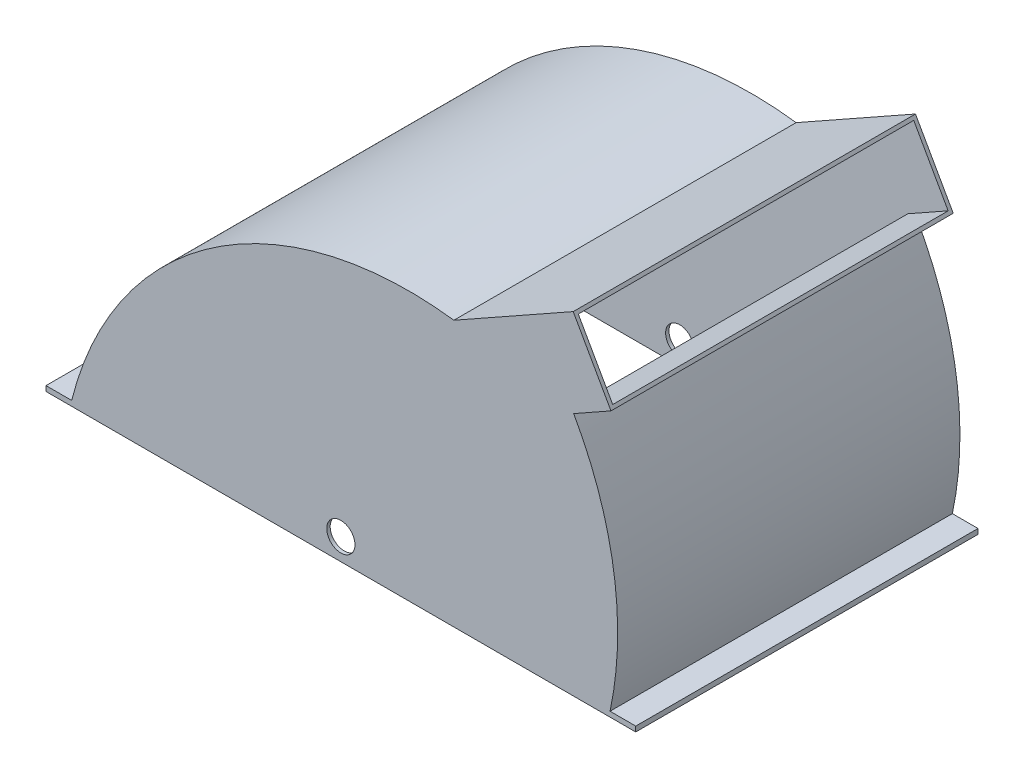
from build123d import *

# Parameters (mm, degrees)
BOSS_EXTRUDE1_DEPTH     = 100
SHELL1_T                = -2
SKETCH4_W               = 14.567996804
SKETCH4_H               = 196
SKETCH4_W_2             = 15.490077846
BOSS_EXTRUDE2_DEPTH     = 1
CUT_EXTRUDE1_DEPTH      = 327.114830331
CUT_EXTRUDE1_DEPTH_BACK = 327.114830331
SKETCH5_R               = 8.25


with BuildPart() as part:
    # Sketch1 → Boss-Extrude1 (new, symmetric)
    with BuildSketch(Plane.XY):
        with BuildLine():
            Line((-157.3, 0), (-172.3, 0))
            Line((-172.3, 0), (-172.3, -3))
            Line((-172.3, -3), (172.3, -3))
            Line((172.3, -3), (172.3, 0))
            Line((172.3, 0), (157.3, 0))
            ThreePointArc((157.3, 0), (159.477998018, 71.943974663), (136.046041615, 140))
            Line((136.046041615, 140), (157.833839596, 152.259358023))
            Line((157.833839596, 152.259358023), (135.766995153, 191.477394389))
            Line((135.766995153, 191.477394389), (66.046041615, 152.247448714))
            ThreePointArc((66.046041615, 152.247448714), (-74.612286943, 118.644986984), (-157.3, 0))
        make_face()
    extrude(amount=BOSS_EXTRUDE1_DEPTH, both=True)

    # Shell1
    shell1_openings = [part.faces().sort_by_distance(p)[0] for p in [
        (146.800417374, 171.868376206, 0),
        (0, -3, 0),
    ]]
    offset(amount=SHELL1_T, openings=shell1_openings, kind=Kind.INTERSECTION)

    # Sketch4 → Boss-Extrude2 (add)
    with BuildSketch(Plane.XZ.offset(2)):
        with Locations((-163.016001598, 0)):
            Rectangle(SKETCH4_W, SKETCH4_H)
        with Locations((162.554961077, 0)):
            Rectangle(SKETCH4_W_2, SKETCH4_H)
    extrude(amount=BOSS_EXTRUDE2_DEPTH)

    # Sketch5 → Cut-Extrude1 (cut, two sides: drawn at the far end of the back side and taken through both)
    with BuildSketch(Plane.XY.offset(100).offset(-CUT_EXTRUDE1_DEPTH_BACK)):
        with Locations((0, 9.692663859)):
            Circle(SKETCH5_R)
    extrude(amount=CUT_EXTRUDE1_DEPTH + CUT_EXTRUDE1_DEPTH_BACK, mode=Mode.SUBTRACT)


solid = part.part
